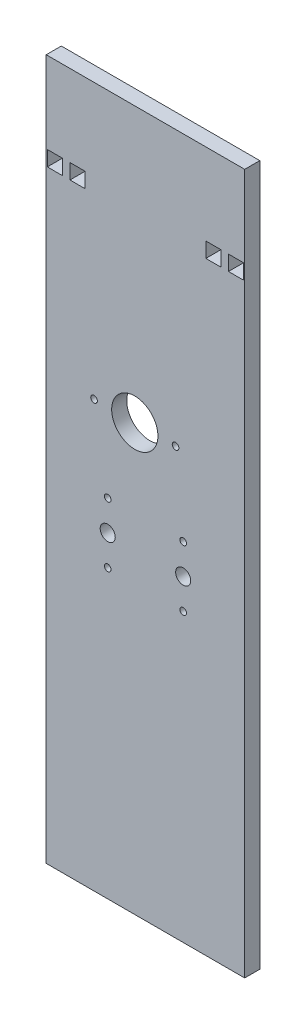
from build123d import *

# Parameters (mm, degrees)
SKETCH1_W           = 96.2
SKETCH1_H           = 294.64
SKETCH1_R           = 1.3890625
SKETCH1_R_2         = 3.175
SKETCH1_R_3         = 9.7282
SKETCH1_W_2         = 6.35
SKETCH1_H_2         = 6.35
BOSS_EXTRUDE1_DEPTH = 6.35
SKETCH3_W           = 6.35
SKETCH3_H           = 294.64
CUT_EXTRUDE2_DEPTH  = 6.35
SKETCH4_W           = 6.35
SKETCH4_H           = 294.64
CUT_EXTRUDE3_DEPTH  = 6.35


with BuildPart() as part:
    # Sketch1 → Boss-Extrude1 (new body)
    with BuildSketch(Plane.XY):
        with Locations((48.1, 147.32)):
            Rectangle(SKETCH1_W, SKETCH1_H)
        with Locations((63.9749986, 120.65)):
            Circle(SKETCH1_R, mode=Mode.SUBTRACT)
        with Locations((63.9749986, 133.35)):
            Circle(SKETCH1_R_2, mode=Mode.SUBTRACT)
        with Locations((63.9749986, 146.05)):
            Circle(SKETCH1_R, mode=Mode.SUBTRACT)
        with Locations((32.2250014, 146.05)):
            Circle(SKETCH1_R, mode=Mode.SUBTRACT)
        with Locations((32.2250014, 133.35)):
            Circle(SKETCH1_R_2, mode=Mode.SUBTRACT)
        with Locations((32.2250014, 120.65)):
            Circle(SKETCH1_R, mode=Mode.SUBTRACT)
        with Locations((60.754989798, 179.209178053)):
            Circle(SKETCH1_R, mode=Mode.SUBTRACT)
        with Locations((26.464989798, 179.209178053)):
            Circle(SKETCH1_R, mode=Mode.SUBTRACT)
        with Locations((43.609989798, 179.209178053)):
            Circle(SKETCH1_R_3, mode=Mode.SUBTRACT)
        with Locations((86.2, 257.175)):
            Rectangle(SKETCH1_W_2, SKETCH1_H_2, mode=Mode.SUBTRACT)
        with Locations((76.675, 257.175)):
            Rectangle(SKETCH1_W_2, SKETCH1_H_2, mode=Mode.SUBTRACT)
        with Locations((19.525, 257.175)):
            Rectangle(SKETCH1_W_2, SKETCH1_H_2, mode=Mode.SUBTRACT)
        with Locations((10, 257.175)):
            Rectangle(SKETCH1_W_2, SKETCH1_H_2, mode=Mode.SUBTRACT)
    extrude(amount=BOSS_EXTRUDE1_DEPTH)

    # Sketch3 → Cut-Extrude2 (cut)
    with BuildSketch(Plane.ZY):
        with Locations((3.175, 147.32)):
            Rectangle(SKETCH3_W, SKETCH3_H)
    extrude(amount=-CUT_EXTRUDE2_DEPTH, mode=Mode.SUBTRACT)

    # Sketch4 → Cut-Extrude3 (cut)
    with BuildSketch(Plane(origin=(96.2, 0, 0), x_dir=(0, 0, -1), z_dir=(1, 0, 0))):
        with Locations((-3.175, 147.32)):
            Rectangle(SKETCH4_W, SKETCH4_H)
    extrude(amount=-CUT_EXTRUDE3_DEPTH, mode=Mode.SUBTRACT)


solid = part.part
